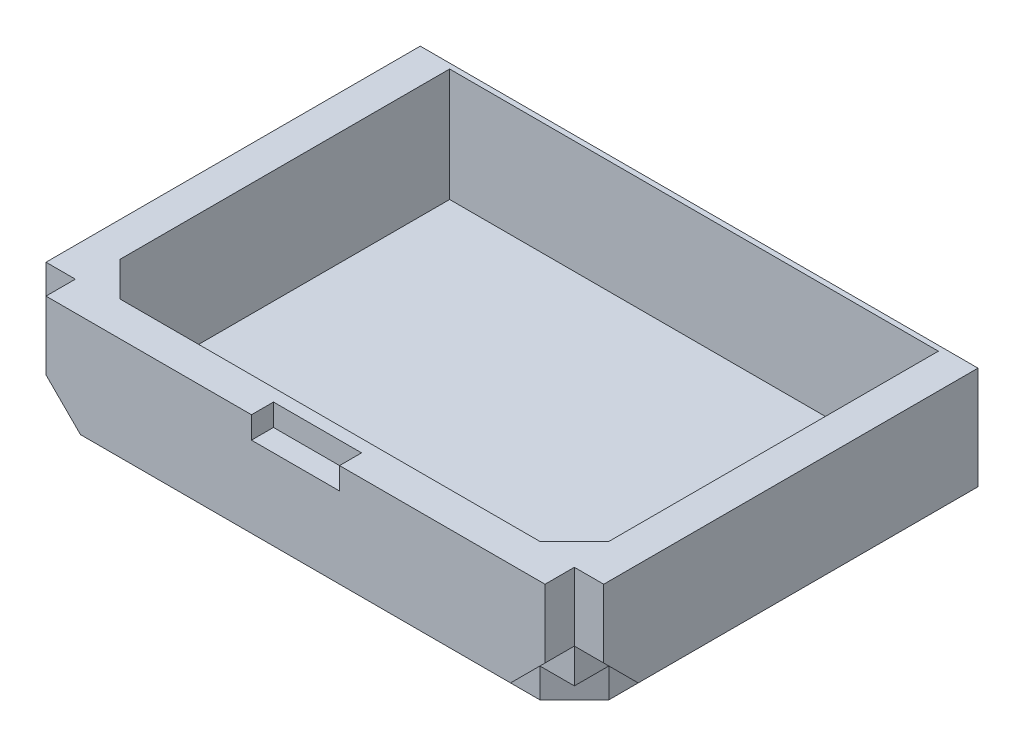
from build123d import *

# Parameters (mm, degrees)
SKETCH_1_W          = 380
SKETCH_1_H          = 275
EXTRUDE_1_DEPTH     = 90
SKETCH_2_W          = 20
SKETCH_2_H          = 20
CUT_EXTRUDE_1_DEPTH = 90
SKETCH_4_W          = 20
SKETCH_4_H          = 20
CUT_EXTRUDE_3_DEPTH = 255
SKETCH_5_W          = 20
SKETCH_5_H          = 20
CUT_EXTRUDE_4_DEPTH = 340
CUT_EXTRUDE_5_DEPTH = 77
SKETCH_7_W          = 60
SKETCH_7_H          = 15
CUT_EXTRUDE_6_DEPTH = 15
CUT_EXTRUDE_7_DEPTH = 20
CUT_EXTRUDE_8_DEPTH = 20
CUT_EXTRUDE_9_DEPTH = 20


with BuildPart() as part:
    # 草圖1 → 填料-伸長1 (new body)
    with BuildSketch(Plane(origin=(0, 0, 0), x_dir=(1, 0, 0), z_dir=(0, 1, 0))):
        Rectangle(SKETCH_1_W, SKETCH_1_H)
    extrude(amount=EXTRUDE_1_DEPTH)

    # 草圖2 → 除料-伸長1 (cut)
    with BuildSketch(Plane(origin=(0, 90, 0), x_dir=(1, 0, 0), z_dir=(0, 1, 0))):
        with Locations((-180, -127.5)):
            Rectangle(SKETCH_2_W, SKETCH_2_H)
        with Locations((180, -127.5)):
            Rectangle(SKETCH_2_W, SKETCH_2_H)
    extrude(amount=-CUT_EXTRUDE_1_DEPTH, mode=Mode.SUBTRACT)

    # 草圖4 → 除料-伸長3 (cut)
    with BuildSketch(Plane.XY.offset(117.5)):
        with Locations((-180, 10)):
            Rectangle(SKETCH_4_W, SKETCH_4_H)
        with Locations((180, 10)):
            Rectangle(SKETCH_4_W, SKETCH_4_H)
    extrude(amount=-CUT_EXTRUDE_3_DEPTH, mode=Mode.SUBTRACT)

    # 草圖5 → 除料-伸長4 (cut)
    with BuildSketch(Plane.ZY.offset(170)):
        with Locations((127.5, 10)):
            Rectangle(SKETCH_5_W, SKETCH_5_H)
    extrude(amount=-CUT_EXTRUDE_4_DEPTH, mode=Mode.SUBTRACT)

    # 草圖6 → 除料-伸長5 (cut)
    with BuildSketch(Plane(origin=(0, 90, 0), x_dir=(1, 0, 0), z_dir=(0, 1, 0))):
        Polygon((-166.5, 134), (166.5, 134), (166.5, -90.5), (143, -114), (-143, -114), (-166.5, -90.5), align=None)
    extrude(amount=-CUT_EXTRUDE_5_DEPTH, mode=Mode.SUBTRACT)

    # 草圖7 → 除料-伸長6 (cut)
    with BuildSketch(Plane.XY.offset(137.5)):
        with Locations((0, 82.5)):
            Rectangle(SKETCH_7_W, SKETCH_7_H)
    extrude(amount=-CUT_EXTRUDE_6_DEPTH, mode=Mode.SUBTRACT)

    # 草圖9 → 除料-伸長7 (cut)
    with BuildSketch(Plane.XY.offset(137.5)):
        Polygon((-170, 20), (-170, 43.5), (-146.5, 20), align=None)
        Polygon((170, 43.5), (146.5, 20), (170, 20), align=None)
    extrude(amount=-CUT_EXTRUDE_7_DEPTH, mode=Mode.SUBTRACT)

    # 草圖10 → 除料-伸長8 (cut)
    with BuildSketch(Plane(origin=(190, 0, 0), x_dir=(0, 0, -1), z_dir=(1, 0, 0))):
        Polygon((-94, 20), (-117.5, 20), (-117.5, 43.5), align=None)
    cut_extrude_8 = extrude(amount=-CUT_EXTRUDE_8_DEPTH, mode=Mode.SUBTRACT)

    # 鏡射1: 除料-伸長8 across plane
    add(cut_extrude_8.mirror(Plane(origin=(0, 0, 0), x_dir=(0, 0, 1), z_dir=(1, 0, 0))), mode=Mode.SUBTRACT)

    # 草圖11 → 除料-伸長9 (cut)
    with BuildSketch(Plane.XZ):
        Polygon((-146.5, 117.5), (-170, 117.5), (-170, 94), align=None)
        Polygon((170, 94), (146.5, 117.5), (170, 117.5), align=None)
    extrude(amount=-CUT_EXTRUDE_9_DEPTH, mode=Mode.SUBTRACT)


solid = part.part
